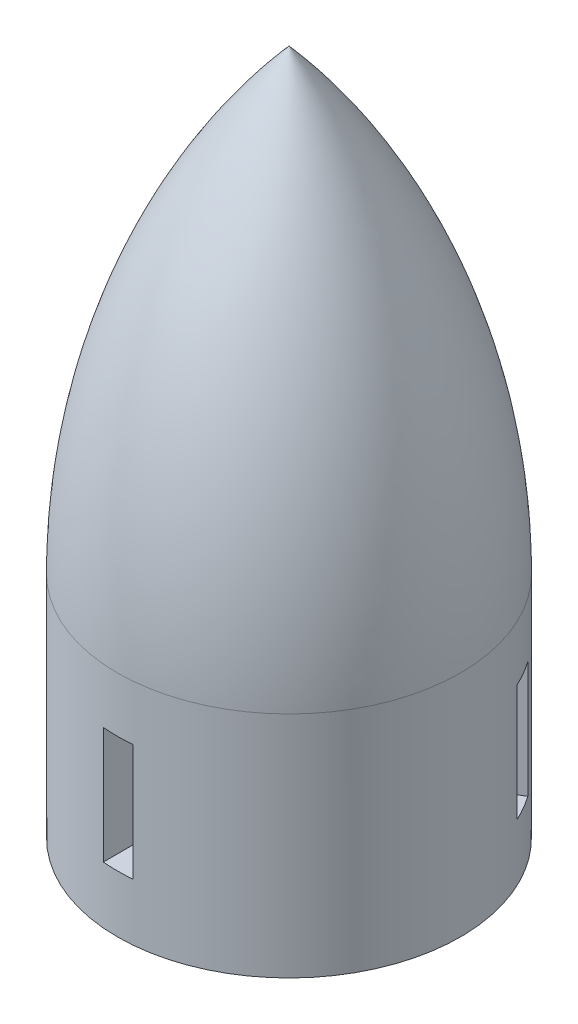
from build123d import *

# Parameters (mm, degrees)
SKETCH1_R           = 19.05
BOSS_EXTRUDE1_DEPTH = 25.4
CUT_EXTRUDE1_DEPTH  = 12.7
SKETCH4_W           = 3.302
SKETCH4_H           = 12.954
CUT_EXTRUDE2_DEPTH  = 6.35
CIRPATTERN1_COUNT   = 3


with BuildPart() as part:
    # Sketch1 → Boss-Extrude1 (new body)
    with BuildSketch(Plane(origin=(0, 0, 0), x_dir=(1, 0, 0), z_dir=(0, 1, 0))):
        with Locations(Location((0, 0, 0), (0, 0, 270))):
            Circle(SKETCH1_R)
    extrude(amount=BOSS_EXTRUDE1_DEPTH)

    # Sketch2 → Cut-Extrude1 (cut)
    with BuildSketch(Plane.XZ):
        Polygon((-1.27, 1.962892204), (-1.27, 3.683), (1.27, 3.683), (1.27, 1.962892204), (1.962892204, 1.27), (3.683, 1.27), (3.683, -1.27), (1.962892204, -1.27), (1.27, -1.962892204), (1.27, -3.683), (-1.27, -3.683), (-1.27, -1.962892204), (-1.962892204, -1.27), (-3.683, -1.27), (-3.683, 1.27), (-1.962892204, 1.27), align=None)
    extrude(amount=-CUT_EXTRUDE1_DEPTH, mode=Mode.SUBTRACT)

    # Sketch3 → Revolve1 (revolve)
    with BuildSketch(Plane.XY):
        with BuildLine():
            Line((0, 76.2), (0, 25.4))
            Line((0, 25.4), (19.05, 25.4))
            ThreePointArc((19.05, 25.4), (14.130898377, 52.527211891), (0, 76.2))
        make_face()
    revolve(axis=Axis((0, 76.2, 0), (0, -1, 0)))

    # Sketch4 → Cut-Extrude2 (cut)
    with BuildSketch(Plane.XY.offset(19.05)):
        with Locations((0, 12.827)):
            Rectangle(SKETCH4_W, SKETCH4_H)
    cut_extrude2 = extrude(amount=-CUT_EXTRUDE2_DEPTH, mode=Mode.SUBTRACT)

    # CirPattern1: Cut-Extrude2 ×3 about axis
    cirpattern1_axis = Axis((0, 0, 0), (0, 1, 0))
    for i in range(1, CIRPATTERN1_COUNT):
        add(cut_extrude2.rotate(cirpattern1_axis, i * 360 / CIRPATTERN1_COUNT), mode=Mode.SUBTRACT)


solid = part.part
